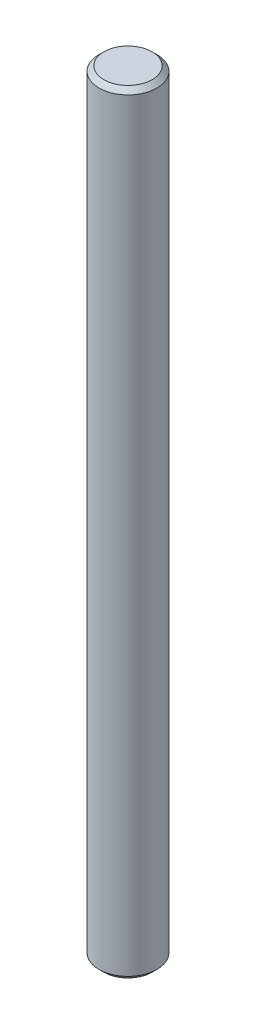
from build123d import *

# Parameters (mm, degrees)
SKETCH1_R           = 3
BOSS_EXTRUDE1_DEPTH = 80
CHAMFER1_SIZE       = 0.5


with BuildPart() as part:
    # Sketch1 → Boss-Extrude1 (new body)
    with BuildSketch(Plane(origin=(0, 0, 0), x_dir=(1, 0, 0), z_dir=(0, 1, 0))):
        with Locations(Location((0, 0, 0), (0, 0, 270))):
            Circle(SKETCH1_R)
    extrude(amount=BOSS_EXTRUDE1_DEPTH)

    # Chamfer1
    chamfer1_edges = [part.edges().sort_by_distance(p)[0] for p in [
        (0, 0, -3),
        (0, 80, -3),
    ]]
    chamfer(chamfer1_edges, length=CHAMFER1_SIZE)


solid = part.part
